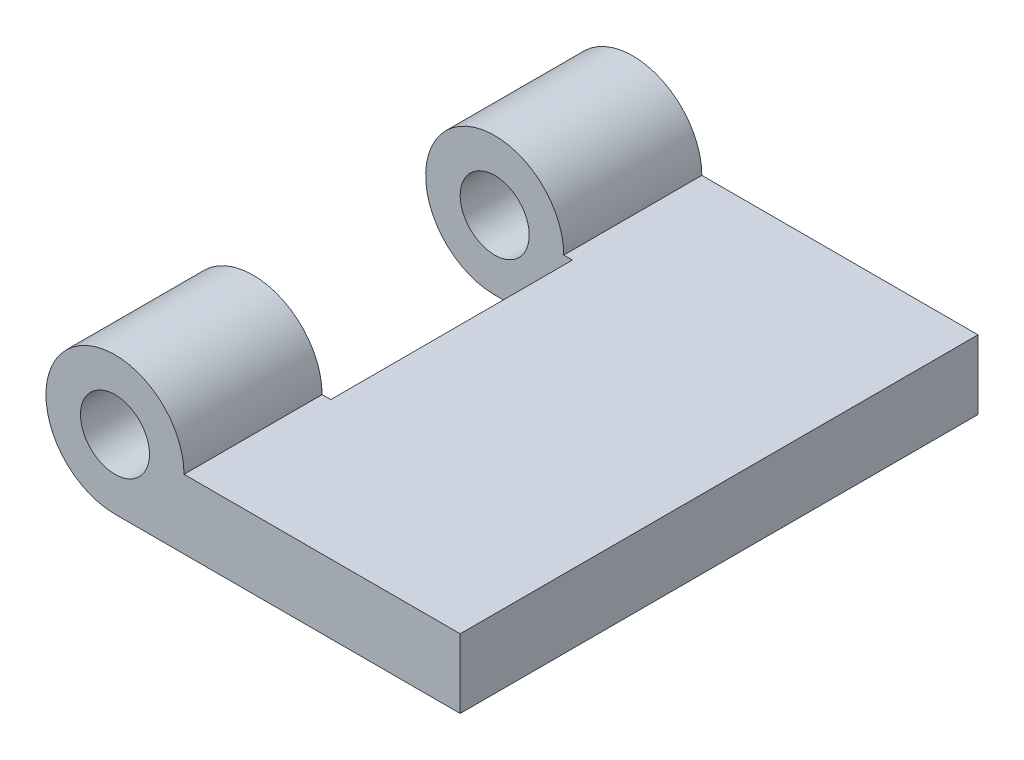
from build123d import *

# Parameters (mm, degrees)
EXTRUDE_1_DEPTH     = 30
SKETCH_2_W          = 9
SKETCH_2_H          = 14
CUT_EXTRUDE_1_DEPTH = 15
SKETCH_3_R          = 2
CUT_EXTRUDE_2_DEPTH = 32


with BuildPart() as part:
    # 草图1 → 凸台-拉伸1 (new body)
    with BuildSketch(Plane.XY):
        with BuildLine():
            Line((4, 0), (20, 0))
            Line((20, 0), (20, -4))
            Line((20, -4), (0, -4))
            ThreePointArc((0, -4), (-2.828427125, 2.828427125), (4, 0))
        make_face()
    extrude(amount=EXTRUDE_1_DEPTH)

    # 草图2 → 切除-拉伸1 (cut)
    with BuildSketch(Plane.XZ.offset(4)):
        with Locations((0, 15)):
            Rectangle(SKETCH_2_W, SKETCH_2_H)
    extrude(amount=-CUT_EXTRUDE_1_DEPTH, mode=Mode.SUBTRACT)

    # 草图3 → 切除-拉伸2 (cut)
    with BuildSketch(Plane(origin=(0, 0, 0), x_dir=(-1, 0, 0), z_dir=(0, 0, -1))):
        with Locations(Location((0, 0, 0), (0, 0, 180))):
            Circle(SKETCH_3_R)
    extrude(amount=-CUT_EXTRUDE_2_DEPTH, mode=Mode.SUBTRACT)


solid = part.part
